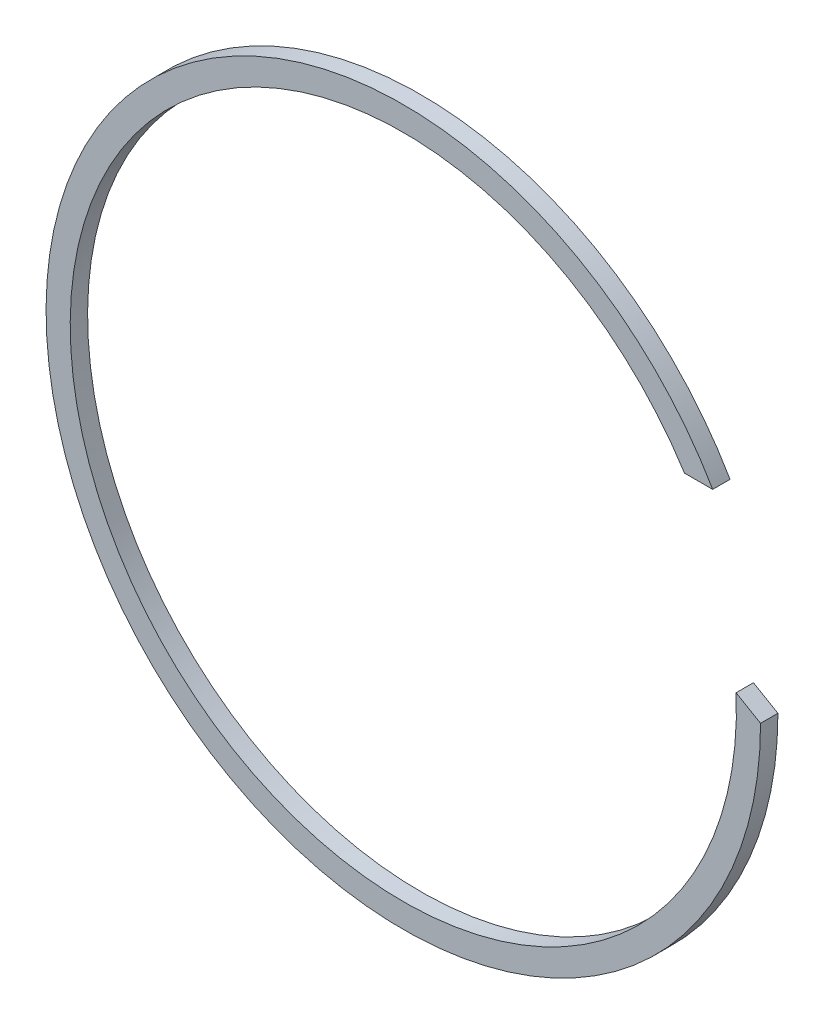
from build123d import *

# Parameters (mm, degrees)
BASE_EXTRUSION_DEPTH = 1.8


with BuildPart() as part:
    # Esquisse1 → Base-Extrusion (new body)
    with BuildSketch(Plane.XY):
        with BuildLine():
            Line((37, 0), (34.468445757, 1.475210857))
            ThreePointArc((34.468445757, 1.475210857), (-32.914243805, -10.339369167), (29.120439557, 18.5))
            Line((29.120439557, 18.5), (32.04293994, 18.5))
            ThreePointArc((32.04293994, 18.5), (-35.739255573, -9.576304669), (37, 0))
        make_face()
    extrude(amount=BASE_EXTRUSION_DEPTH)


solid = part.part
